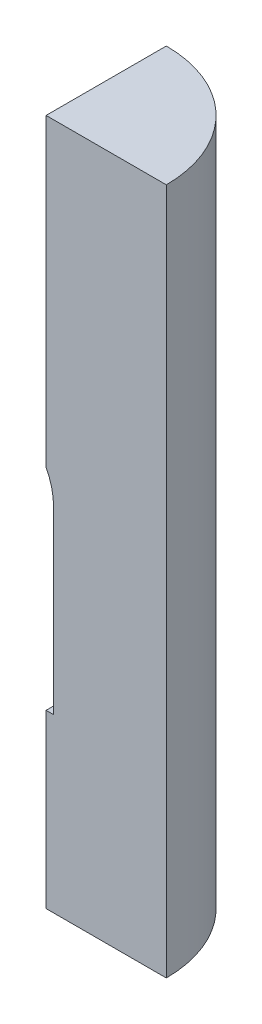
from build123d import *

# Parameters (mm, degrees)
INLET_SECTION_DEPTH  = 3000
OUTLET_START         = -1000
OUTLET_SECTION_DEPTH = 1000


with BuildPart() as part:
    # Sketch1 → Inlet Section (new body)
    with BuildSketch(Plane(origin=(0, 0, 0), x_dir=(1, 0, 0), z_dir=(0, 1, 0))):
        with BuildLine():
            Line((700, 0), (0, 0))
            Line((0, 0), (0, 700))
            ThreePointArc((0, 700), (494.974746831, 494.974746831), (700, 0))
        make_face()
    extrude(amount=INLET_SECTION_DEPTH)

    # Sketch1<2> → Outlet Section (add)
    with BuildSketch(Plane(origin=(0, 0, 0), x_dir=(1, 0, 0), z_dir=(0, 1, 0)).offset(OUTLET_START)):
        with BuildLine():
            Line((700, 0), (0, 0))
            Line((0, 0), (0, 700))
            ThreePointArc((0, 700), (494.974746831, 494.974746831), (700, 0))
        make_face()
    extrude(amount=OUTLET_SECTION_DEPTH)

    # Sketch2 → Rocket Body (revolve, cut)
    with BuildSketch(Plane.XY):
        with BuildLine():
            Line((0, 0), (43.5, 0))
            Line((43.5, 0), (43.5, 1050))
            ThreePointArc((43.5, 1050), (32.462012135, 1140.162700159), (0, 1225))
            Line((0, 1225), (0, 0))
        make_face()
    revolve(axis=Axis((0, 1225, 0), (0, -1, 0)), mode=Mode.SUBTRACT)

    # Sketch5 → Fin section 0
    with BuildSketch(Plane(origin=(148.492424049, 0, -148.492424049), x_dir=(-0.7071067811865414, 0, -0.7071067811865537), z_dir=(0.7071067811865537, 0, -0.7071067811865414))):
        with BuildLine():
            Line((1, 0), (-1, 0))
            add(Edge.make_bspline(
                [(-1, 0), (-2.806434263, 15.569219932), (-3.946739239, 29.594971133), (-4, 45)],
                knots=[0, 0, 0, 0, 1, 1, 1, 1], degree=3))
            Line((-4, 45), (-4, 100))
            add(Edge.make_bspline(
                [(0, 135), (-4, 135), (-4, 117.5), (-4, 100)],
                knots=[0, 0, 0, 0, 1, 1, 1, 1], degree=3))
            add(Edge.make_bspline(
                [(0, 135), (4, 135), (4, 117.5), (4, 100)],
                knots=[0, 0, 0, 0, 1, 1, 1, 1], degree=3))
            Line((4, 100), (4, 45))
            add(Edge.make_bspline(
                [(1, 0), (2.806434263, 15.569219932), (3.946739239, 29.594971133), (4, 45)],
                knots=[0, 0, 0, 0, 1, 1, 1, 1], degree=3))
        make_face()
    # Sketch4 → Fin section 1
    with BuildSketch(Plane(origin=(0, 0, 0), x_dir=(-0.7071067811865414, 0, -0.7071067811865537), z_dir=(0.7071067811865537, 0, -0.7071067811865414))):
        with BuildLine():
            Line((4, 45), (4, 155))
            add(Edge.make_bspline(
                [(0, 190), (4, 190), (3.555879761, 173.373397407), (4, 155)],
                knots=[0, 0, 0, 0, 1, 1, 1, 1], degree=3))
            add(Edge.make_bspline(
                [(0, 190), (-4, 190), (-3.555879761, 173.373397407), (-4, 155)],
                knots=[0, 0, 0, 0, 1, 1, 1, 1], degree=3))
            Line((-4, 155), (-4, 45))
            add(Edge.make_bspline(
                [(-1, 0), (-3.156657645, 16.863770489), (-3.729577703, 30.414594212), (-4, 45)],
                knots=[0, 0, 0, 0, 1, 1, 1, 1], degree=3))
            Line((-1, 0), (1, 0))
            add(Edge.make_bspline(
                [(1, 0), (3.156657645, 16.863770489), (3.729577703, 30.414594212), (4, 45)],
                knots=[0, 0, 0, 0, 1, 1, 1, 1], degree=3))
        make_face()
    loft(mode=Mode.SUBTRACT)


solid = part.part
